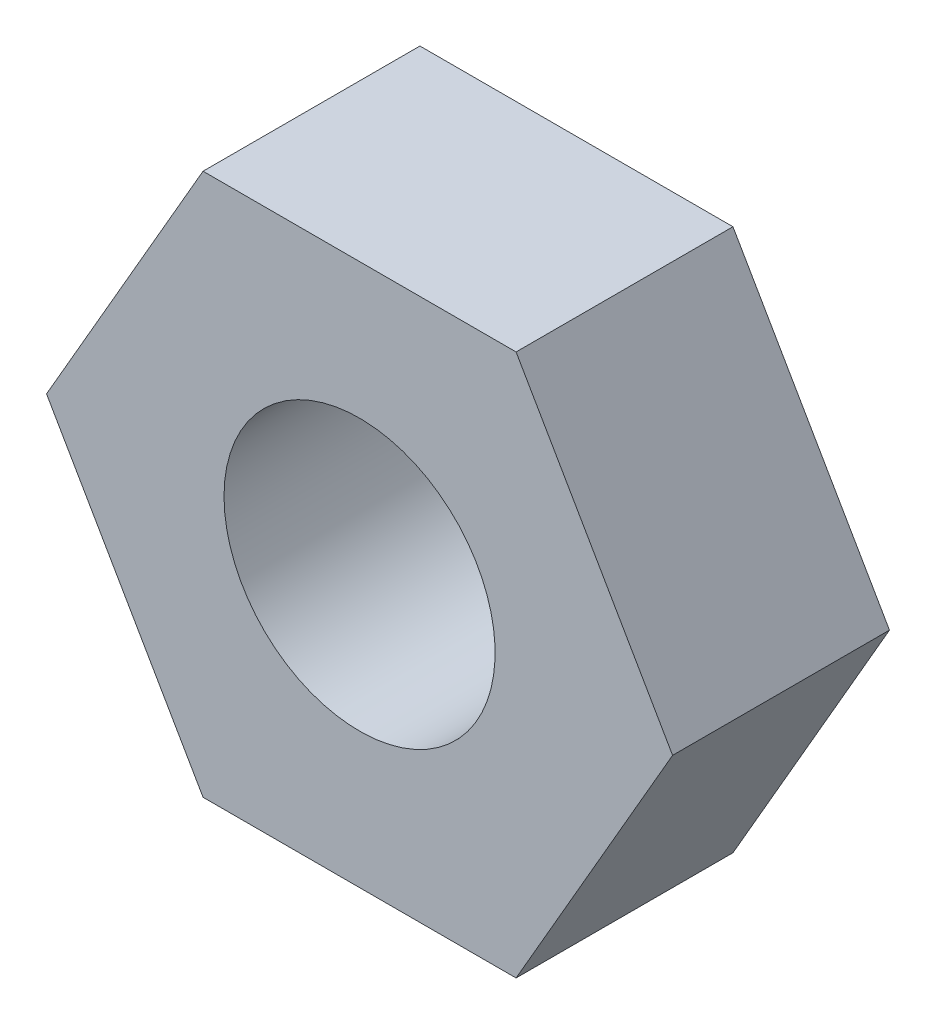
from build123d import *

# Parameters (mm, degrees)
BOSS_EXTRUDE1_DEPTH = 1.6
SKETCH2_R           = 1
CUT_EXTRUDE1_DEPTH  = 1.6


with BuildPart() as part:
    # Sketch1 → Boss-Extrude1 (new body)
    with BuildSketch(Plane.XY):
        Polygon((2.309401077, 0), (1.154700538, 2), (-1.154700538, 2), (-2.309401077, 0), (-1.154700538, -2), (1.154700538, -2), align=None)
    extrude(amount=BOSS_EXTRUDE1_DEPTH)

    # Sketch2 → Cut-Extrude1 (cut)
    with BuildSketch(Plane(origin=(0, 0, 0), x_dir=(-1, 0, 0), z_dir=(0, 0, -1))):
        Circle(SKETCH2_R)
    extrude(amount=-CUT_EXTRUDE1_DEPTH, mode=Mode.SUBTRACT)


solid = part.part
